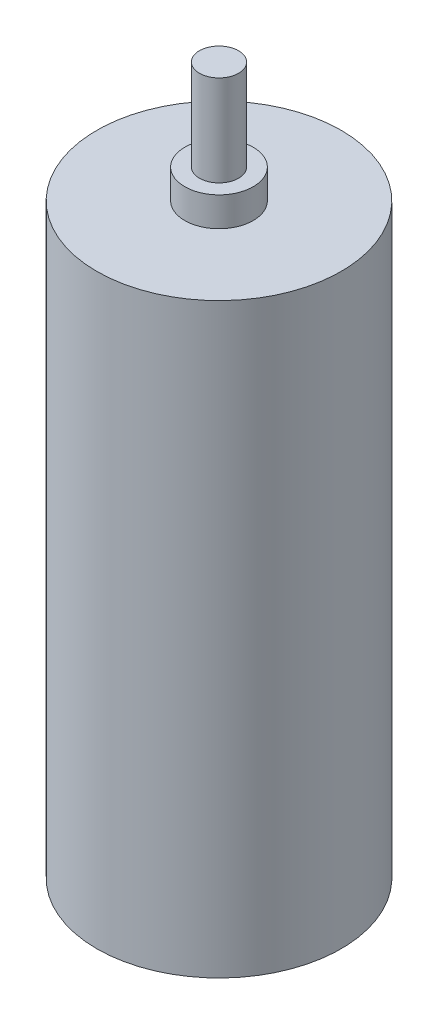
from build123d import *

# Parameters (mm, degrees)
SKETCH1_R           = 12.5
BOSS_EXTRUDE1_DEPTH = 60
SKETCH2_R           = 3.5
BOSS_EXTRUDE2_DEPTH = 3
SKETCH3_R           = 2
BOSS_EXTRUDE3_DEPTH = 9.3


with BuildPart() as part:
    # Sketch1 → Boss-Extrude1 (new body)
    with BuildSketch(Plane(origin=(0, 0, 0), x_dir=(1, 0, 0), z_dir=(0, 1, 0))):
        with Locations(Location((0, 0, 0), (0, 0, 270))):
            Circle(SKETCH1_R)
    extrude(amount=-BOSS_EXTRUDE1_DEPTH)

    # Sketch2 → Boss-Extrude2 (add)
    with BuildSketch(Plane(origin=(0, 0, 0), x_dir=(1, 0, 0), z_dir=(0, 1, 0))):
        with Locations(Location((0, 0, 0), (0, 0, 270))):
            Circle(SKETCH2_R)
    extrude(amount=BOSS_EXTRUDE2_DEPTH)

    # Sketch3 → Boss-Extrude3 (add)
    with BuildSketch(Plane(origin=(0, 3, 0), x_dir=(1, 0, 0), z_dir=(0, 1, 0))):
        with Locations(Location((0, 0, 0), (0, 0, 270))):
            Circle(SKETCH3_R)
    extrude(amount=BOSS_EXTRUDE3_DEPTH)


solid = part.part
